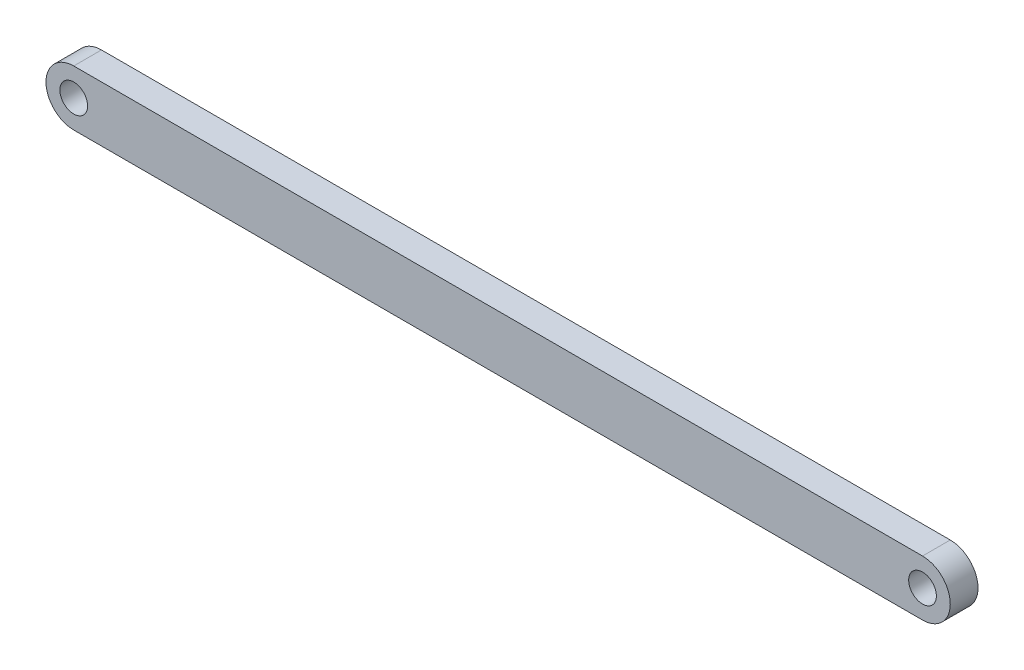
from build123d import *

# Parameters (mm, degrees)
SKETCH_1_R      = 5
EXTRUDE_1_DEPTH = 10


with BuildPart() as part:
    # 草图1 → 凸台-拉伸1 (new body)
    with BuildSketch(Plane.XY):
        with BuildLine():
            Line((0, 10), (306, 10))
            ThreePointArc((306, 10), (316, 0), (306, -10))
            Line((306, -10), (0, -10))
            ThreePointArc((0, -10), (-10, 0), (0, 10))
        make_face()
        Circle(SKETCH_1_R, mode=Mode.SUBTRACT)
        with Locations((306, 0)):
            Circle(SKETCH_1_R, mode=Mode.SUBTRACT)
    extrude(amount=EXTRUDE_1_DEPTH)


solid = part.part
